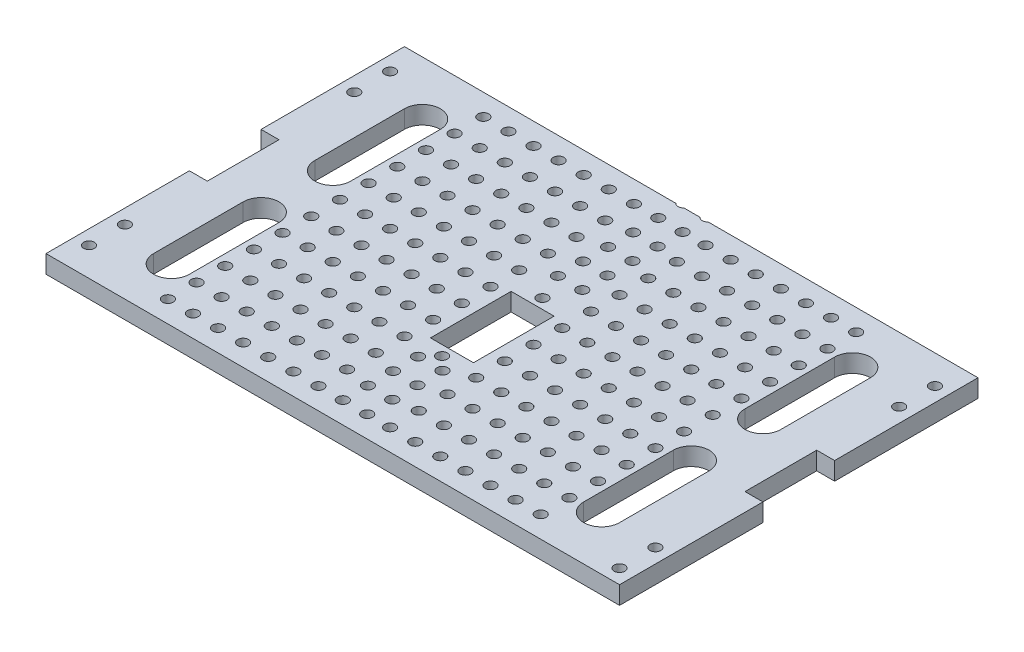
from build123d import *

# Parameters (mm, degrees)
SKETCH1_W                 = 160
SKETCH1_H                 = 100
BOSS_EXTRUDE1_DEPTH       = 5
SKETCH2_R                 = 3
CUT_EXTRUDE1_DEPTH        = 95.472218138
SKETCH12_W                = 5
SKETCH12_H                = 20
CUT_EXTRUDE9_DEPTH        = 95.472218138
SKETCH13_R                = 1.5
SKETCH13_W                = 12
SKETCH13_H                = 22.5
CUT_EXTRUDE10_DEPTH       = 95.472218138
SKETCH14_R                = 1.5
CUT_EXTRUDE11_DEPTH       = 95.472218138
CUT_EXTRUDE12_DEPTH       = 10
SKETCH16_R                = 1.5
CUT_EXTRUDE13_DEPTH       = 95.472218138
LPATTERN1_COUNT           = 12
LPATTERN1_PITCH           = 8
MIRROR7_COPY_1_SKETCH_R   = 1.5
MIRROR7_COPY_1_DEPTH      = 95.472218138
MIRROR7_COPY_2_SKETCH_R   = 1.5
MIRROR7_COPY_2_DEPTH      = 95.472218138
MIRROR7_COPY_3_SKETCH_R   = 1.5
MIRROR7_COPY_3_DEPTH      = 95.472218138
MIRROR7_COPY_4_SKETCH_R   = 1.5
MIRROR7_COPY_4_DEPTH      = 95.472218138
MIRROR7_COPY_5_SKETCH_R   = 1.5
MIRROR7_COPY_5_DEPTH      = 95.472218138
MIRROR7_COPY_6_SKETCH_R   = 1.5
MIRROR7_COPY_6_DEPTH      = 95.472218138
MIRROR7_COPY_7_SKETCH_R   = 1.5
MIRROR7_COPY_7_DEPTH      = 95.472218138
MIRROR7_COPY_8_SKETCH_R   = 1.5
MIRROR7_COPY_8_DEPTH      = 95.472218138
MIRROR7_COPY_9_SKETCH_R   = 1.5
MIRROR7_COPY_9_DEPTH      = 95.472218138
MIRROR7_COPY_10_SKETCH_R  = 1.5
MIRROR7_COPY_10_DEPTH     = 95.472218138
MIRROR7_COPY_11_SKETCH_R  = 1.5
MIRROR7_COPY_11_DEPTH     = 95.472218138
SKETCH17_R                = 1.5
CUT_EXTRUDE14_DEPTH       = 95.472218138
LPATTERN2_COUNT           = 5
LPATTERN2_PITCH           = 7
LPATTERN3_COUNT           = 4
LPATTERN3_PITCH           = 7
LPATTERN3_COPY_1_SKETCH_R = 1.5
LPATTERN3_COPY_1_DEPTH    = 95.472218138
LPATTERN3_COPY_2_SKETCH_R = 1.5
LPATTERN3_COPY_2_DEPTH    = 95.472218138
LPATTERN3_COPY_3_SKETCH_R = 1.5
LPATTERN3_COPY_3_DEPTH    = 95.472218138


with BuildPart() as part:
    # Sketch1 → Boss-Extrude1 (new body)
    with BuildSketch(Plane(origin=(0, 0, 0), x_dir=(1, 0, 0), z_dir=(0, 1, 0))):
        Rectangle(SKETCH1_W, SKETCH1_H)
    extrude(amount=BOSS_EXTRUDE1_DEPTH)

    # Sketch2 → Cut-Extrude1 (cut, through all)
    with BuildSketch(Plane(origin=(0, 5, 0), x_dir=(1, 0, 0), z_dir=(0, 1, 0))):
        with Locations(Location((0, 0, 0), (0, 0, 270))):
            Circle(SKETCH2_R)
    extrude(amount=-CUT_EXTRUDE1_DEPTH, mode=Mode.SUBTRACT)

    # Sketch12 → Cut-Extrude9 (cut, through all)
    with BuildSketch(Plane(origin=(0, 5, 0), x_dir=(1, 0, 0), z_dir=(0, 1, 0))):
        with Locations((-77.5, 0)):
            Rectangle(SKETCH12_W, SKETCH12_H)
    cut_extrude9 = extrude(amount=-CUT_EXTRUDE9_DEPTH, mode=Mode.SUBTRACT)

    # Mirror6: Cut-Extrude9 across plane
    add(cut_extrude9.mirror(Plane(origin=(0, 0, 0), x_dir=(0, 0, 1), z_dir=(1, 0, 0))), mode=Mode.SUBTRACT)

    # Sketch13 → Cut-Extrude10 (cut, through all)
    with BuildSketch(Plane(origin=(0, 5, 0), x_dir=(1, 0, 0), z_dir=(0, 1, 0))):
        with Locations(Location((0, 8.5, 0), (0, 0, 270))):
            Circle(SKETCH13_R)
        with Locations(Location((0, -19.5, 0), (0, 0, 270))):
            Circle(SKETCH13_R)
        with Locations((0, -5.5)):
            Rectangle(SKETCH13_W, SKETCH13_H)
    extrude(amount=-CUT_EXTRUDE10_DEPTH, mode=Mode.SUBTRACT)

    # Sketch14 → Cut-Extrude11 (cut, through all)
    with BuildSketch(Plane(origin=(0, 5, 0), x_dir=(1, 0, 0), z_dir=(0, 1, 0))):
        with Locations(Location((-76, 42, 0), (0, 0, 270))):
            Circle(SKETCH14_R)
        with Locations(Location((-76, 32, 0), (0, 0, 270))):
            Circle(SKETCH14_R)
        with Locations(Location((-76, -42, 0), (0, 0, 270))):
            Circle(SKETCH14_R)
        with Locations(Location((-76, -32, 0), (0, 0, 270))):
            Circle(SKETCH14_R)
        with Locations(Location((76, -36, 0), (0, 0, 270))):
            Circle(SKETCH14_R)
        with Locations(Location((76, -46, 0), (0, 0, 270))):
            Circle(SKETCH14_R)
        with Locations(Location((76, 42, 0), (0, 0, 270))):
            Circle(SKETCH14_R)
        with Locations(Location((76, 32, 0), (0, 0, 270))):
            Circle(SKETCH14_R)
    extrude(amount=-CUT_EXTRUDE11_DEPTH, mode=Mode.SUBTRACT)

    # Sketch15 → Cut-Extrude12 (cut)
    with BuildSketch(Plane(origin=(0, 5, 0), x_dir=(1, 0, 0), z_dir=(0, 1, 0))):
        with BuildLine():
            Line((-55, 35), (-55, 10))
            ThreePointArc((-55, 10), (-60, 5), (-65, 10))
            Line((-65, 10), (-65, 35))
            ThreePointArc((-65, 35), (-60, 40), (-55, 35))
        make_face()
        with BuildLine():
            Line((-55, -10), (-55, -35))
            ThreePointArc((-55, -35), (-60, -40), (-65, -35))
            Line((-65, -35), (-65, -10))
            ThreePointArc((-65, -10), (-60, -5), (-55, -10))
        make_face()
    cut_extrude12 = extrude(amount=-CUT_EXTRUDE12_DEPTH, mode=Mode.SUBTRACT)

    # Sketch16 → Cut-Extrude13 (cut, through all)
    with BuildSketch(Plane(origin=(0, 5, 0), x_dir=(1, 0, 0), z_dir=(0, 1, 0))):
        with Locations(Location((-52, 44, 0), (0, 0, 270))):
            Circle(SKETCH16_R)
        with Locations(Location((-45, 44, 0), (0, 0, 270))):
            Circle(SKETCH16_R)
        with Locations(Location((-38, 44, 0), (0, 0, 270))):
            Circle(SKETCH16_R)
        with Locations(Location((-31, 44, 0), (0, 0, 270))):
            Circle(SKETCH16_R)
        with Locations(Location((-24, 44, 0), (0, 0, 270))):
            Circle(SKETCH16_R)
        with Locations(Location((-17, 44, 0), (0, 0, 270))):
            Circle(SKETCH16_R)
        with Locations(Location((-10, 44, 0), (0, 0, 270))):
            Circle(SKETCH16_R)
    cut_extrude13 = extrude(amount=-CUT_EXTRUDE13_DEPTH, mode=Mode.SUBTRACT)

    # LPattern1: Cut-Extrude13 ×12
    with Locations(*[(0, 0, i * LPATTERN1_PITCH) for i in range(1, LPATTERN1_COUNT)]):
        add(cut_extrude13, mode=Mode.SUBTRACT)

    # Mirror7: Cut-Extrude12, Cut-Extrude13 across plane
    add(cut_extrude12.mirror(Plane(origin=(0, 0, 0), x_dir=(0, 0, 1), z_dir=(1, 0, 0))), mode=Mode.SUBTRACT)
    add(cut_extrude13.mirror(Plane(origin=(0, 0, 0), x_dir=(0, 0, 1), z_dir=(1, 0, 0))), mode=Mode.SUBTRACT)

    # Mirror7 copy 1 sketch → Mirror7 copy 1 (cut, through all)
    with BuildSketch(Plane(origin=(0, 5, 8), x_dir=(-1, 0, 0), z_dir=(0, 1, 0))):
        with Locations((-52, -44)):
            Circle(MIRROR7_COPY_1_SKETCH_R)
        with Locations((-45, -44)):
            Circle(MIRROR7_COPY_1_SKETCH_R)
        with Locations((-38, -44)):
            Circle(MIRROR7_COPY_1_SKETCH_R)
        with Locations((-31, -44)):
            Circle(MIRROR7_COPY_1_SKETCH_R)
        with Locations((-24, -44)):
            Circle(MIRROR7_COPY_1_SKETCH_R)
        with Locations((-17, -44)):
            Circle(MIRROR7_COPY_1_SKETCH_R)
        with Locations((-10, -44)):
            Circle(MIRROR7_COPY_1_SKETCH_R)
    extrude(amount=-MIRROR7_COPY_1_DEPTH, mode=Mode.SUBTRACT)

    # Mirror7 copy 2 sketch → Mirror7 copy 2 (cut, through all)
    with BuildSketch(Plane(origin=(0, 5, 16), x_dir=(-1, 0, 0), z_dir=(0, 1, 0))):
        with Locations((-52, -44)):
            Circle(MIRROR7_COPY_2_SKETCH_R)
        with Locations((-45, -44)):
            Circle(MIRROR7_COPY_2_SKETCH_R)
        with Locations((-38, -44)):
            Circle(MIRROR7_COPY_2_SKETCH_R)
        with Locations((-31, -44)):
            Circle(MIRROR7_COPY_2_SKETCH_R)
        with Locations((-24, -44)):
            Circle(MIRROR7_COPY_2_SKETCH_R)
        with Locations((-17, -44)):
            Circle(MIRROR7_COPY_2_SKETCH_R)
        with Locations((-10, -44)):
            Circle(MIRROR7_COPY_2_SKETCH_R)
    extrude(amount=-MIRROR7_COPY_2_DEPTH, mode=Mode.SUBTRACT)

    # Mirror7 copy 3 sketch → Mirror7 copy 3 (cut, through all)
    with BuildSketch(Plane(origin=(0, 5, 24), x_dir=(-1, 0, 0), z_dir=(0, 1, 0))):
        with Locations((-52, -44)):
            Circle(MIRROR7_COPY_3_SKETCH_R)
        with Locations((-45, -44)):
            Circle(MIRROR7_COPY_3_SKETCH_R)
        with Locations((-38, -44)):
            Circle(MIRROR7_COPY_3_SKETCH_R)
        with Locations((-31, -44)):
            Circle(MIRROR7_COPY_3_SKETCH_R)
        with Locations((-24, -44)):
            Circle(MIRROR7_COPY_3_SKETCH_R)
        with Locations((-17, -44)):
            Circle(MIRROR7_COPY_3_SKETCH_R)
        with Locations((-10, -44)):
            Circle(MIRROR7_COPY_3_SKETCH_R)
    extrude(amount=-MIRROR7_COPY_3_DEPTH, mode=Mode.SUBTRACT)

    # Mirror7 copy 4 sketch → Mirror7 copy 4 (cut, through all)
    with BuildSketch(Plane(origin=(0, 5, 32), x_dir=(-1, 0, 0), z_dir=(0, 1, 0))):
        with Locations((-52, -44)):
            Circle(MIRROR7_COPY_4_SKETCH_R)
        with Locations((-45, -44)):
            Circle(MIRROR7_COPY_4_SKETCH_R)
        with Locations((-38, -44)):
            Circle(MIRROR7_COPY_4_SKETCH_R)
        with Locations((-31, -44)):
            Circle(MIRROR7_COPY_4_SKETCH_R)
        with Locations((-24, -44)):
            Circle(MIRROR7_COPY_4_SKETCH_R)
        with Locations((-17, -44)):
            Circle(MIRROR7_COPY_4_SKETCH_R)
        with Locations((-10, -44)):
            Circle(MIRROR7_COPY_4_SKETCH_R)
    extrude(amount=-MIRROR7_COPY_4_DEPTH, mode=Mode.SUBTRACT)

    # Mirror7 copy 5 sketch → Mirror7 copy 5 (cut, through all)
    with BuildSketch(Plane(origin=(0, 5, 40), x_dir=(-1, 0, 0), z_dir=(0, 1, 0))):
        with Locations((-52, -44)):
            Circle(MIRROR7_COPY_5_SKETCH_R)
        with Locations((-45, -44)):
            Circle(MIRROR7_COPY_5_SKETCH_R)
        with Locations((-38, -44)):
            Circle(MIRROR7_COPY_5_SKETCH_R)
        with Locations((-31, -44)):
            Circle(MIRROR7_COPY_5_SKETCH_R)
        with Locations((-24, -44)):
            Circle(MIRROR7_COPY_5_SKETCH_R)
        with Locations((-17, -44)):
            Circle(MIRROR7_COPY_5_SKETCH_R)
        with Locations((-10, -44)):
            Circle(MIRROR7_COPY_5_SKETCH_R)
    extrude(amount=-MIRROR7_COPY_5_DEPTH, mode=Mode.SUBTRACT)

    # Mirror7 copy 6 sketch → Mirror7 copy 6 (cut, through all)
    with BuildSketch(Plane(origin=(0, 5, 48), x_dir=(-1, 0, 0), z_dir=(0, 1, 0))):
        with Locations((-52, -44)):
            Circle(MIRROR7_COPY_6_SKETCH_R)
        with Locations((-45, -44)):
            Circle(MIRROR7_COPY_6_SKETCH_R)
        with Locations((-38, -44)):
            Circle(MIRROR7_COPY_6_SKETCH_R)
        with Locations((-31, -44)):
            Circle(MIRROR7_COPY_6_SKETCH_R)
        with Locations((-24, -44)):
            Circle(MIRROR7_COPY_6_SKETCH_R)
        with Locations((-17, -44)):
            Circle(MIRROR7_COPY_6_SKETCH_R)
        with Locations((-10, -44)):
            Circle(MIRROR7_COPY_6_SKETCH_R)
    extrude(amount=-MIRROR7_COPY_6_DEPTH, mode=Mode.SUBTRACT)

    # Mirror7 copy 7 sketch → Mirror7 copy 7 (cut, through all)
    with BuildSketch(Plane(origin=(0, 5, 56), x_dir=(-1, 0, 0), z_dir=(0, 1, 0))):
        with Locations((-52, -44)):
            Circle(MIRROR7_COPY_7_SKETCH_R)
        with Locations((-45, -44)):
            Circle(MIRROR7_COPY_7_SKETCH_R)
        with Locations((-38, -44)):
            Circle(MIRROR7_COPY_7_SKETCH_R)
        with Locations((-31, -44)):
            Circle(MIRROR7_COPY_7_SKETCH_R)
        with Locations((-24, -44)):
            Circle(MIRROR7_COPY_7_SKETCH_R)
        with Locations((-17, -44)):
            Circle(MIRROR7_COPY_7_SKETCH_R)
        with Locations((-10, -44)):
            Circle(MIRROR7_COPY_7_SKETCH_R)
    extrude(amount=-MIRROR7_COPY_7_DEPTH, mode=Mode.SUBTRACT)

    # Mirror7 copy 8 sketch → Mirror7 copy 8 (cut, through all)
    with BuildSketch(Plane(origin=(0, 5, 64), x_dir=(-1, 0, 0), z_dir=(0, 1, 0))):
        with Locations((-52, -44)):
            Circle(MIRROR7_COPY_8_SKETCH_R)
        with Locations((-45, -44)):
            Circle(MIRROR7_COPY_8_SKETCH_R)
        with Locations((-38, -44)):
            Circle(MIRROR7_COPY_8_SKETCH_R)
        with Locations((-31, -44)):
            Circle(MIRROR7_COPY_8_SKETCH_R)
        with Locations((-24, -44)):
            Circle(MIRROR7_COPY_8_SKETCH_R)
        with Locations((-17, -44)):
            Circle(MIRROR7_COPY_8_SKETCH_R)
        with Locations((-10, -44)):
            Circle(MIRROR7_COPY_8_SKETCH_R)
    extrude(amount=-MIRROR7_COPY_8_DEPTH, mode=Mode.SUBTRACT)

    # Mirror7 copy 9 sketch → Mirror7 copy 9 (cut, through all)
    with BuildSketch(Plane(origin=(0, 5, 72), x_dir=(-1, 0, 0), z_dir=(0, 1, 0))):
        with Locations((-52, -44)):
            Circle(MIRROR7_COPY_9_SKETCH_R)
        with Locations((-45, -44)):
            Circle(MIRROR7_COPY_9_SKETCH_R)
        with Locations((-38, -44)):
            Circle(MIRROR7_COPY_9_SKETCH_R)
        with Locations((-31, -44)):
            Circle(MIRROR7_COPY_9_SKETCH_R)
        with Locations((-24, -44)):
            Circle(MIRROR7_COPY_9_SKETCH_R)
        with Locations((-17, -44)):
            Circle(MIRROR7_COPY_9_SKETCH_R)
        with Locations((-10, -44)):
            Circle(MIRROR7_COPY_9_SKETCH_R)
    extrude(amount=-MIRROR7_COPY_9_DEPTH, mode=Mode.SUBTRACT)

    # Mirror7 copy 10 sketch → Mirror7 copy 10 (cut, through all)
    with BuildSketch(Plane(origin=(0, 5, 80), x_dir=(-1, 0, 0), z_dir=(0, 1, 0))):
        with Locations((-52, -44)):
            Circle(MIRROR7_COPY_10_SKETCH_R)
        with Locations((-45, -44)):
            Circle(MIRROR7_COPY_10_SKETCH_R)
        with Locations((-38, -44)):
            Circle(MIRROR7_COPY_10_SKETCH_R)
        with Locations((-31, -44)):
            Circle(MIRROR7_COPY_10_SKETCH_R)
        with Locations((-24, -44)):
            Circle(MIRROR7_COPY_10_SKETCH_R)
        with Locations((-17, -44)):
            Circle(MIRROR7_COPY_10_SKETCH_R)
        with Locations((-10, -44)):
            Circle(MIRROR7_COPY_10_SKETCH_R)
    extrude(amount=-MIRROR7_COPY_10_DEPTH, mode=Mode.SUBTRACT)

    # Mirror7 copy 11 sketch → Mirror7 copy 11 (cut, through all)
    with BuildSketch(Plane(origin=(0, 5, 88), x_dir=(-1, 0, 0), z_dir=(0, 1, 0))):
        with Locations((-52, -44)):
            Circle(MIRROR7_COPY_11_SKETCH_R)
        with Locations((-45, -44)):
            Circle(MIRROR7_COPY_11_SKETCH_R)
        with Locations((-38, -44)):
            Circle(MIRROR7_COPY_11_SKETCH_R)
        with Locations((-31, -44)):
            Circle(MIRROR7_COPY_11_SKETCH_R)
        with Locations((-24, -44)):
            Circle(MIRROR7_COPY_11_SKETCH_R)
        with Locations((-17, -44)):
            Circle(MIRROR7_COPY_11_SKETCH_R)
        with Locations((-10, -44)):
            Circle(MIRROR7_COPY_11_SKETCH_R)
    extrude(amount=-MIRROR7_COPY_11_DEPTH, mode=Mode.SUBTRACT)

    # Sketch17 → Cut-Extrude14 (cut, through all)
    with BuildSketch(Plane(origin=(0, 5, 0), x_dir=(1, 0, 0), z_dir=(0, 1, 0))):
        with Locations(Location((-3.2, 44, 0), (0, 0, 270))):
            Circle(SKETCH17_R)
        with Locations(Location((3.6, 44, 0), (0, 0, 270))):
            Circle(SKETCH17_R)
    cut_extrude14 = extrude(amount=-CUT_EXTRUDE14_DEPTH, mode=Mode.SUBTRACT)

    # LPattern2: Cut-Extrude14 ×5
    with Locations(*[(0, 0, i * LPATTERN2_PITCH) for i in range(1, LPATTERN2_COUNT)]):
        add(cut_extrude14, mode=Mode.SUBTRACT)

    # Mirror8: Cut-Extrude14 across plane
    add(cut_extrude14.mirror(Plane.XY), mode=Mode.SUBTRACT)

    # LPattern3: Cut-Extrude14 ×4
    with Locations(*[(0, 0, -i * LPATTERN3_PITCH) for i in range(1, LPATTERN3_COUNT)]):
        add(cut_extrude14, mode=Mode.SUBTRACT)

    # LPattern3 copy 1 sketch → LPattern3 copy 1 (cut, through all)
    with BuildSketch(Plane(origin=(0, 5, -7), x_dir=(1, 0, 0), z_dir=(0, 1, 0))):
        with Locations((-3.2, -44)):
            Circle(LPATTERN3_COPY_1_SKETCH_R)
        with Locations((3.6, -44)):
            Circle(LPATTERN3_COPY_1_SKETCH_R)
    extrude(amount=-LPATTERN3_COPY_1_DEPTH, mode=Mode.SUBTRACT)

    # LPattern3 copy 2 sketch → LPattern3 copy 2 (cut, through all)
    with BuildSketch(Plane(origin=(0, 5, -14), x_dir=(1, 0, 0), z_dir=(0, 1, 0))):
        with Locations((-3.2, -44)):
            Circle(LPATTERN3_COPY_2_SKETCH_R)
        with Locations((3.6, -44)):
            Circle(LPATTERN3_COPY_2_SKETCH_R)
    extrude(amount=-LPATTERN3_COPY_2_DEPTH, mode=Mode.SUBTRACT)

    # LPattern3 copy 3 sketch → LPattern3 copy 3 (cut, through all)
    with BuildSketch(Plane(origin=(0, 5, -21), x_dir=(1, 0, 0), z_dir=(0, 1, 0))):
        with Locations((-3.2, -44)):
            Circle(LPATTERN3_COPY_3_SKETCH_R)
        with Locations((3.6, -44)):
            Circle(LPATTERN3_COPY_3_SKETCH_R)
    extrude(amount=-LPATTERN3_COPY_3_DEPTH, mode=Mode.SUBTRACT)


solid = part.part
